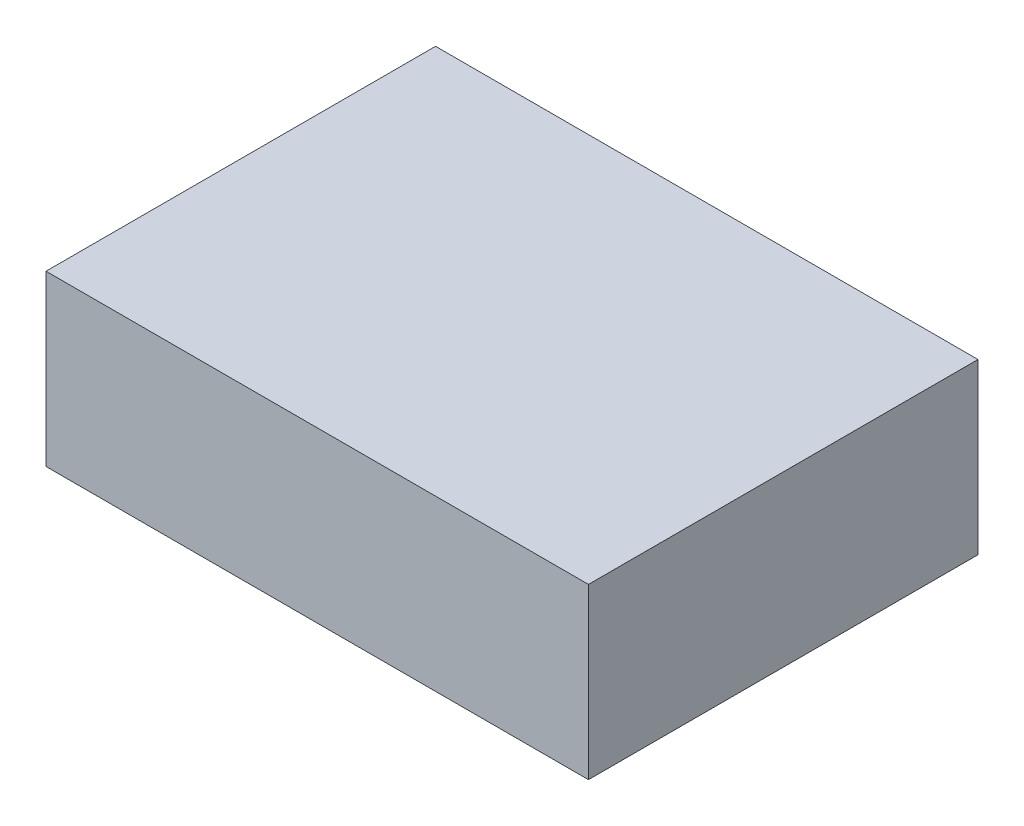
from build123d import *

# Parameters (mm, degrees)
SKETCH1_W           = 145.828523866
SKETCH1_H           = 104.724254123
BOSS_EXTRUDE1_DEPTH = 45.466


with BuildPart() as part:
    # Sketch1 → Boss-Extrude1 (new body)
    with BuildSketch(Plane(origin=(0, 0, 0), x_dir=(1, 0, 0), z_dir=(0, 1, 0))):
        with Locations((15.185016848, -5.759833977)):
            Rectangle(SKETCH1_W, SKETCH1_H)
    extrude(amount=BOSS_EXTRUDE1_DEPTH)


solid = part.part
